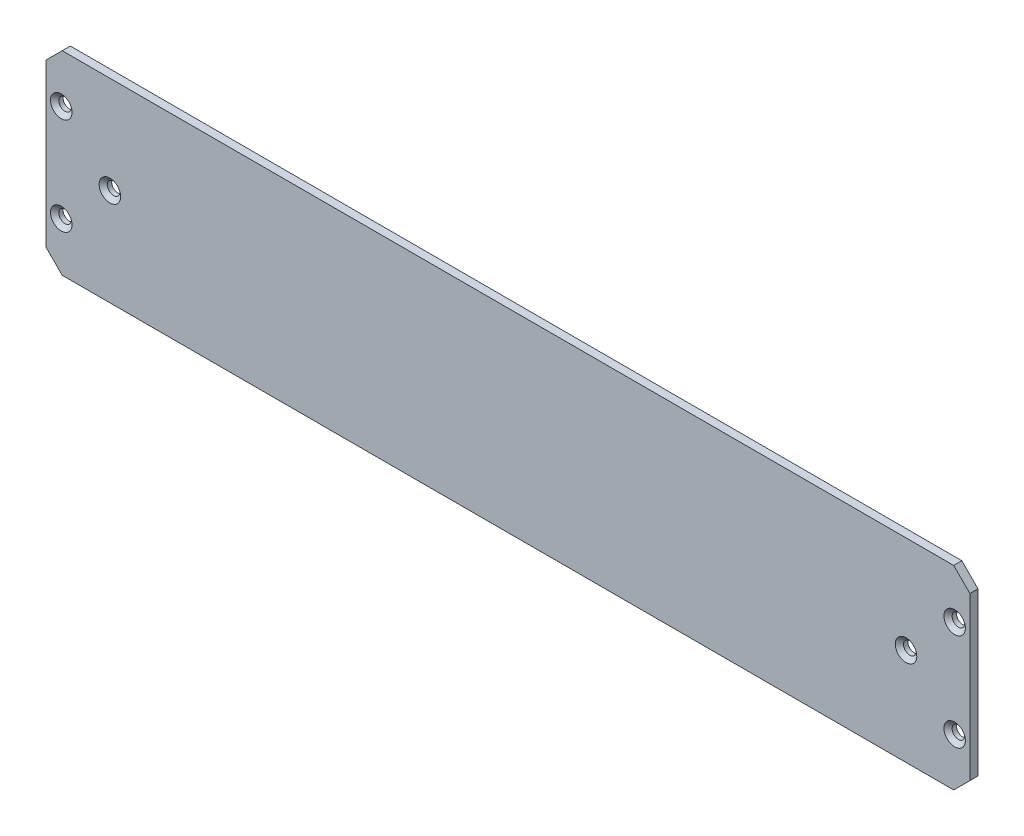
from build123d import *

# Parameters (mm, degrees)
SKETCH1_W                                 = 361.95
SKETCH1_H                                 = 76.2
BOSS_EXTRUDE1_DEPTH                       = 3.175
CSK_FOR_8_FLAT_HEAD_MACHINE_SCREW_2_COUNT = 2
CSK_FOR_8_FLAT_HEAD_MACHINE_SCREW_2_PITCH = 349.999999988
CSK_FOR_8_FLAT_HEAD_MACHINE_SCREW_3_COUNT = 2
CSK_FOR_8_FLAT_HEAD_MACHINE_SCREW_3_PITCH = 352.067621334
CSK_FOR_8_FLAT_HEAD_MACHINE_SCREW_4_COUNT = 2
CSK_FOR_8_FLAT_HEAD_MACHINE_SCREW_4_PITCH = 331.497820494
CSK_FOR_8_FLAT_HEAD_MACHINE_SCREW_5_COUNT = 2
CSK_FOR_8_FLAT_HEAD_MACHINE_SCREW_5_PITCH = 26.940768363
CSK_FOR_8_FLAT_HEAD_MACHINE_SCREW_6_COUNT = 2
CSK_FOR_8_FLAT_HEAD_MACHINE_SCREW_6_PITCH = 38.1
CHAMFER1_SIZE                             = 6.35


with BuildPart() as part:
    # Sketch1 → Boss-Extrude1 (new body)
    with BuildSketch(Plane.XY):
        Rectangle(SKETCH1_W, SKETCH1_H)
    extrude(amount=BOSS_EXTRUDE1_DEPTH)

    # Sketch3 → CSK for #8 Flat Head Machine Screw (100)1 (revolve, cut)
    with BuildSketch(Plane(origin=(-174.999999994, 19.05, 3.175), x_dir=(0, -1, 0), z_dir=(1, 0, 0))):
        Polygon((0, 0), (0, 3.175), (2.45745, 3.175), (2.45745, 1.475934296), (4.2164, 0), align=None)
    csk_for_8_flat_head_machine_screw_100 = revolve(axis=Axis((-174.999999994, 19.05, 9.525), (0, 0, -1)), mode=Mode.SUBTRACT)

    # CSK for _8 Flat Head Machine Screw _ 2: CSK for #8 Flat Head Machine Screw (100)1 ×2
    with Locations(*[(i * CSK_FOR_8_FLAT_HEAD_MACHINE_SCREW_2_PITCH, 0, 0) for i in range(1, CSK_FOR_8_FLAT_HEAD_MACHINE_SCREW_2_COUNT)]):
        add(csk_for_8_flat_head_machine_screw_100, mode=Mode.SUBTRACT)

    # CSK for _8 Flat Head Machine Screw _ 3: CSK for #8 Flat Head Machine Screw (100)1 ×2
    with Locations(*[Vector(0.9941272039220534, -0.10821784705916154, 0) * (i * CSK_FOR_8_FLAT_HEAD_MACHINE_SCREW_3_PITCH) for i in range(1, CSK_FOR_8_FLAT_HEAD_MACHINE_SCREW_3_COUNT)]):
        add(csk_for_8_flat_head_machine_screw_100, mode=Mode.SUBTRACT)

    # CSK for _8 Flat Head Machine Screw _ 4: CSK for #8 Flat Head Machine Screw (100)1 ×2
    with Locations(*[Vector(0.9983474385899155, -0.05746644117182559, 0) * (i * CSK_FOR_8_FLAT_HEAD_MACHINE_SCREW_4_PITCH) for i in range(1, CSK_FOR_8_FLAT_HEAD_MACHINE_SCREW_4_COUNT)]):
        add(csk_for_8_flat_head_machine_screw_100, mode=Mode.SUBTRACT)

    # CSK for _8 Flat Head Machine Screw _ 5: CSK for #8 Flat Head Machine Screw (100)1 ×2
    with Locations(*[Vector(0.7071067811865517, -0.7071067811865435, 0) * (i * CSK_FOR_8_FLAT_HEAD_MACHINE_SCREW_5_PITCH) for i in range(1, CSK_FOR_8_FLAT_HEAD_MACHINE_SCREW_5_COUNT)]):
        add(csk_for_8_flat_head_machine_screw_100, mode=Mode.SUBTRACT)

    # CSK for _8 Flat Head Machine Screw _ 6: CSK for #8 Flat Head Machine Screw (100)1 ×2
    with Locations(*[(0, -i * CSK_FOR_8_FLAT_HEAD_MACHINE_SCREW_6_PITCH, 0) for i in range(1, CSK_FOR_8_FLAT_HEAD_MACHINE_SCREW_6_COUNT)]):
        add(csk_for_8_flat_head_machine_screw_100, mode=Mode.SUBTRACT)

    # Chamfer1
    chamfer1_edges = [part.edges().sort_by_distance(p)[0] for p in [
        (-180.975, 38.1, 1.5875),
        (180.975, 38.1, 1.5875),
        (180.975, -38.1, 1.5875),
        (-180.975, -38.1, 1.5875),
    ]]
    chamfer(chamfer1_edges, length=CHAMFER1_SIZE)


solid = part.part
